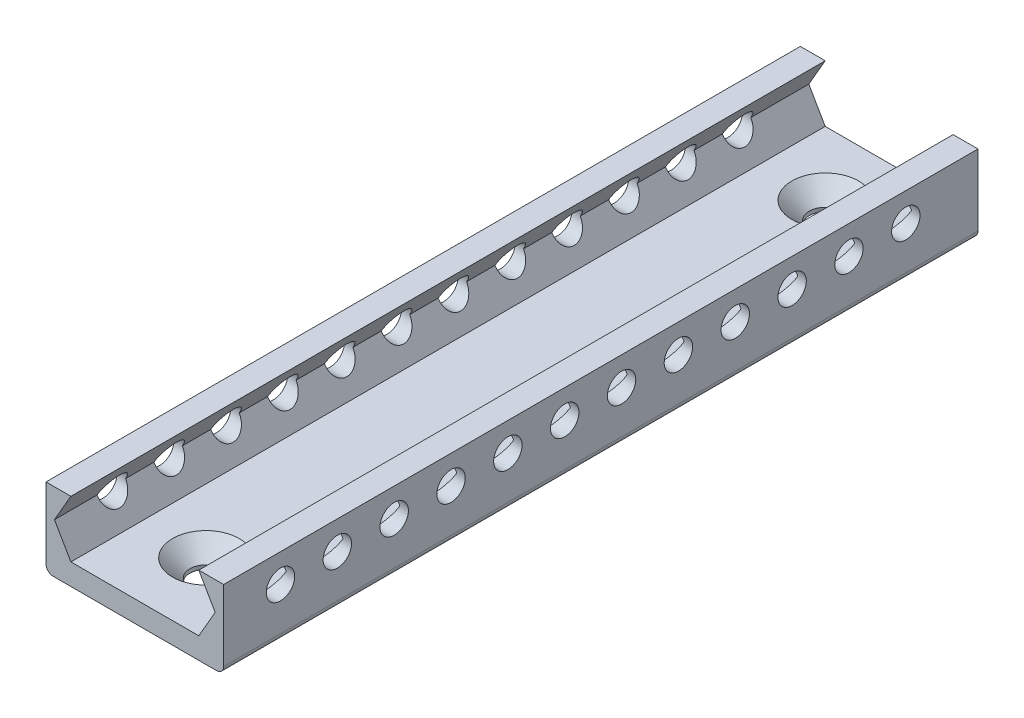
from build123d import *

# Parameters (mm, degrees)
BOSS_EXTRUDE1_DEPTH                            = 106.1617
SKETCH3_R                                      = 2
CUT_EXTRUDE2_DEPTH                             = 100
LPATTERN1_COUNT                                = 12
LPATTERN1_PITCH                                = 8
FILLET1_R                                      = 1
CSK_FOR_M4_FLAT_HEAD_MACHINE_SCREW1_AT_2_COUNT = 2
CSK_FOR_M4_FLAT_HEAD_MACHINE_SCREW1_AT_2_PITCH = 87.1617


with BuildPart() as part:
    # Sketch1 → Boss-Extrude1 (new body)
    with BuildSketch(Plane.XY):
        Polygon((-9, 0), (9, 0), (11.309401077, 4), (9, 8), (12.5, 8), (12.5, -3), (-12.5, -3), (-12.5, 8), (-9, 8), (-11.309401077, 4), align=None)
    extrude(amount=-BOSS_EXTRUDE1_DEPTH)

    # Sketch3 → Cut-Extrude2 (cut)
    with BuildSketch(Plane(origin=(12.5, 0, 0), x_dir=(0, 0, -1), z_dir=(1, 0, 0))):
        with Locations((8, 4)):
            Circle(SKETCH3_R)
    cut_extrude2 = extrude(amount=-CUT_EXTRUDE2_DEPTH, mode=Mode.SUBTRACT)

    # LPattern1: Cut-Extrude2 ×12
    with Locations(*[(0, 0, -i * LPATTERN1_PITCH) for i in range(1, LPATTERN1_COUNT)]):
        add(cut_extrude2, mode=Mode.SUBTRACT)

    # Fillet1
    fillet1_edges = [part.edges().sort_by_distance(p)[0] for p in [
        (12.5, -3, -53.08085),
        (-12.5, -3, -53.08085),
    ]]
    fillet(fillet1_edges, radius=FILLET1_R)

    # Sketch7 → CSK for M4 Flat Head Machine Screw1 (revolve, cut)
    with BuildSketch(Plane(origin=(0, 0, -97.1617), x_dir=(0, 0, 1), z_dir=(1, 0, 0))):
        Polygon((0, 0), (0, 3), (2.25, 3), (2.25, 2.45), (4.7, 0), align=None)
    csk_for_m4_flat_head_machine_screw1 = revolve(axis=Axis((0, 6.35, -97.1617), (0, -1, 0)), mode=Mode.SUBTRACT)

    # CSK for M4 Flat Head Machine Screw1 at 2: CSK for M4 Flat Head Machine Screw1 ×2
    with Locations(*[(0, 0, i * CSK_FOR_M4_FLAT_HEAD_MACHINE_SCREW1_AT_2_PITCH) for i in range(1, CSK_FOR_M4_FLAT_HEAD_MACHINE_SCREW1_AT_2_COUNT)]):
        add(csk_for_m4_flat_head_machine_screw1, mode=Mode.SUBTRACT)


solid = part.part
